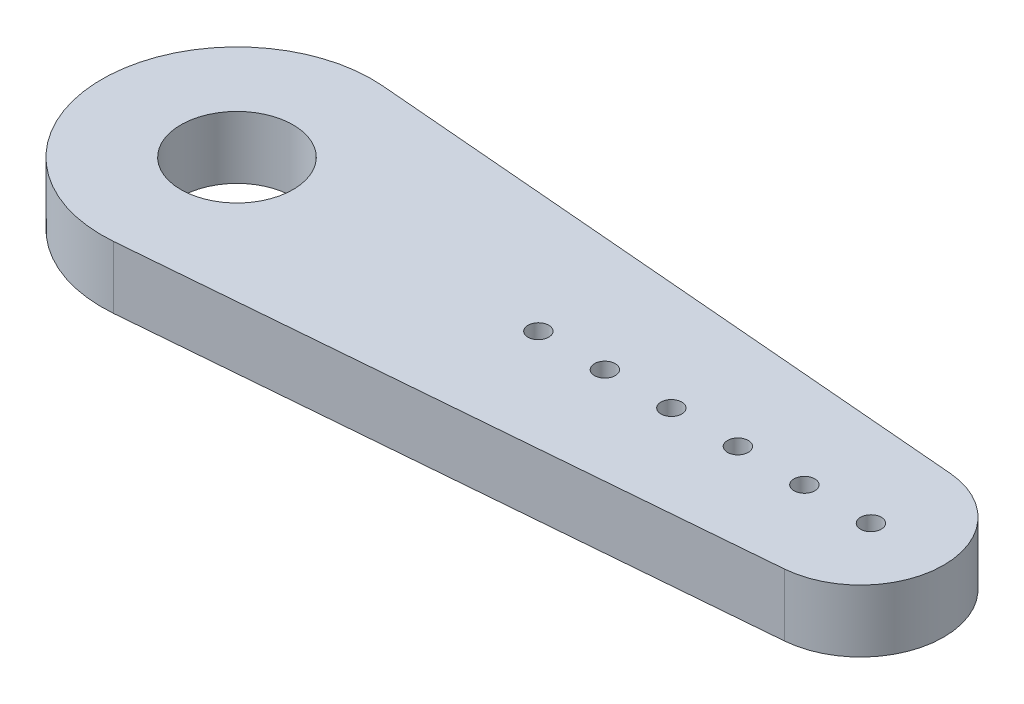
from build123d import *

# Parameters (mm, degrees)
SKETCH1_R           = 0.5
SKETCH1_R_2         = 2.7
BOSS_EXTRUDE2_DEPTH = 3


with BuildPart() as part:
    # Sketch1 → Boss-Extrude2 (new body)
    with BuildSketch(Plane(origin=(0, 0, 0), x_dir=(1, 0, 0), z_dir=(0, 1, 0))):
        with BuildLine():
            Line((0.541666667, 6.477391236), (30.333333333, 3.986086914))
            ThreePointArc((30.333333333, 3.986086914), (34, 0), (30.333333333, -3.986086914))
            Line((30.333333333, -3.986086914), (0.541666667, -6.477391236))
            ThreePointArc((0.541666667, -6.477391236), (-6.5, 0), (0.541666667, 6.477391236))
        make_face()
        with Locations(Location((30.5, 0, 0), (0, 0, 270))):
            Circle(SKETCH1_R, mode=Mode.SUBTRACT)
        with Locations(Location((27.3, 0, 0), (0, 0, 270))):
            Circle(SKETCH1_R, mode=Mode.SUBTRACT)
        with Locations(Location((24.1, 0, 0), (0, 0, 270))):
            Circle(SKETCH1_R, mode=Mode.SUBTRACT)
        with Locations(Location((20.9, 0, 0), (0, 0, 270))):
            Circle(SKETCH1_R, mode=Mode.SUBTRACT)
        with Locations(Location((17.7, 0, 0), (0, 0, 270))):
            Circle(SKETCH1_R, mode=Mode.SUBTRACT)
        with Locations(Location((14.5, 0, 0), (0, 0, 270))):
            Circle(SKETCH1_R, mode=Mode.SUBTRACT)
        with Locations(Location((0, 0, 0), (0, 0, 270))):
            Circle(SKETCH1_R_2, mode=Mode.SUBTRACT)
    extrude(amount=BOSS_EXTRUDE2_DEPTH)


solid = part.part
